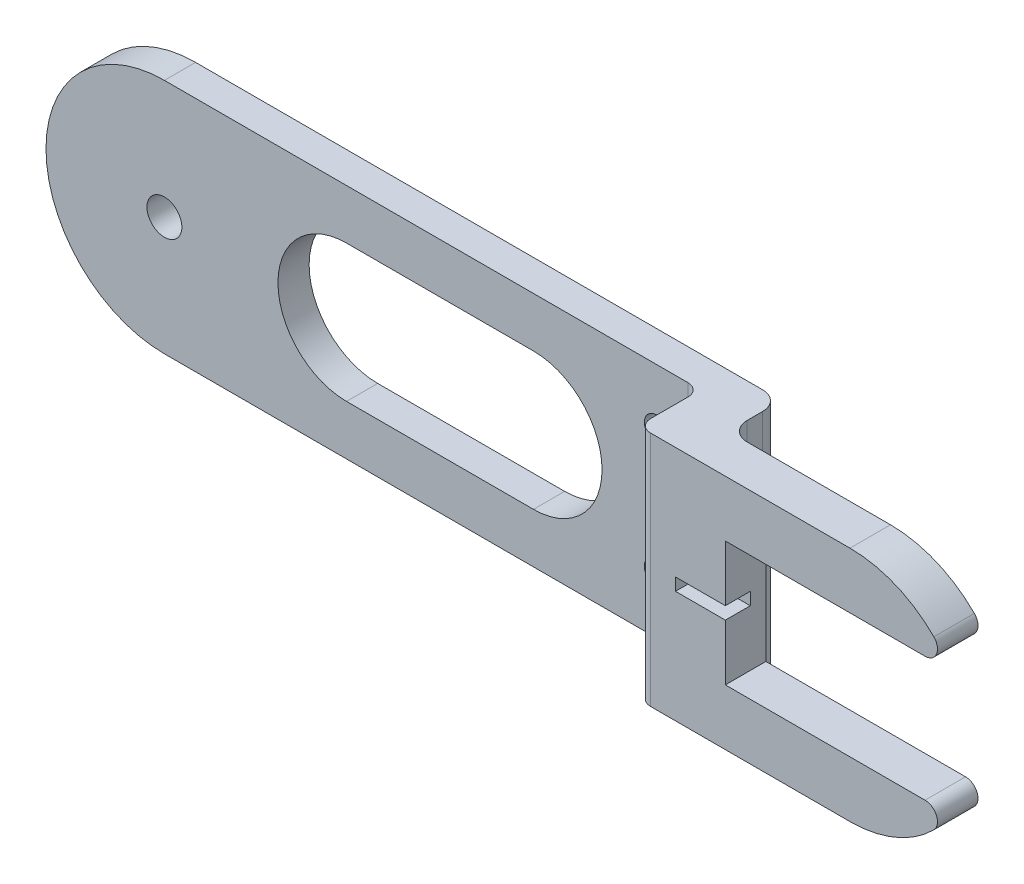
from build123d import *

# Parameters (mm, degrees)
SKETCH1_R           = 2.8
BOSS_EXTRUDE1_DEPTH = 5
FILLET1_R           = 2
BOSS_EXTRUDE2_DEPTH = 10
FILLET2_R           = 2
SKETCH3_W           = 8
SKETCH3_H           = 2
CUT_EXTRUDE1_DEPTH  = 4
SKETCH5_R           = 2
CUT_EXTRUDE2_DEPTH  = 5
SKETCH6_W           = 89.229867451
SKETCH6_H           = 38
CUT_EXTRUDE3_DEPTH  = 8.5
FILLET3_R           = 3


with BuildPart() as part:
    # Sketch1 → Boss-Extrude1 (new body)
    with BuildSketch(Plane.XY):
        with BuildLine():
            Line((0, 19), (120, 19))
            ThreePointArc((120, 19), (129.246621004, 16.598192673), (136.155494421, 10))
            Line((136.155494421, 10), (100, 10))
            Line((100, 10), (100, -10))
            Line((100, -10), (136.155494421, -10))
            ThreePointArc((136.155494421, -10), (129.246621004, -16.598192673), (120, -19))
            Line((120, -19), (0, -19))
            ThreePointArc((0, -19), (-19, 0), (0, 19))
        make_face()
        Circle(SKETCH1_R, mode=Mode.SUBTRACT)
        with BuildLine():
            Line((29.217733251, 11), (59.217733251, 11))
            ThreePointArc((59.217733251, 11), (70.217733251, 0), (59.217733251, -11))
            Line((59.217733251, -11), (29.217733251, -11))
            ThreePointArc((29.217733251, -11), (18.217733251, 0), (29.217733251, 11))
        make_face(mode=Mode.SUBTRACT)
    extrude(amount=BOSS_EXTRUDE1_DEPTH)

    # Fillet1
    fillet1_edges = [part.edges().sort_by_distance(p)[0] for p in [
        (136.155494421, 10, 2.5),
        (136.155494421, -10, 2.5),
    ]]
    fillet(fillet1_edges, radius=FILLET1_R)

    # Sketch2 → Boss-Extrude2 (add)
    with BuildSketch(Plane.XY.offset(5)):
        with BuildLine():
            Line((86, 19), (86, -19))
            Line((86, -19), (120, -19))
            ThreePointArc((120, -19), (127.286167394, -17.547414758), (133.458252765, -13.411764706))
            ThreePointArc((133.458252765, -13.411764706), (133.888690869, -11.233035011), (132.041594579, -10))
            Line((132.041594579, -10), (100, -10))
            Line((100, -10), (100, 10))
            Line((100, 10), (132.041594579, 10))
            ThreePointArc((132.041594579, 10), (133.888690869, 11.233035011), (133.458252765, 13.411764706))
            ThreePointArc((133.458252765, 13.411764706), (127.286167394, 17.547414758), (120, 19))
            Line((120, 19), (86, 19))
        make_face()
    extrude(amount=BOSS_EXTRUDE2_DEPTH)

    # Fillet2
    fillet2_edges = [part.edges().sort_by_distance(p)[0] for p in [
        (86, 0, 5),
        (86, 0, 15),
    ]]
    fillet(fillet2_edges, radius=FILLET2_R)

    # Sketch3 → Cut-Extrude1 (cut)
    with BuildSketch(Plane.XY.offset(15)):
        with Locations((96, 0)):
            Rectangle(SKETCH3_W, SKETCH3_H)
    extrude(amount=-CUT_EXTRUDE1_DEPTH, mode=Mode.SUBTRACT)

    # Sketch5 → Cut-Extrude2 (cut)
    with BuildSketch(Plane.XY.offset(5)):
        with Locations((79, 10)):
            Circle(SKETCH5_R)
        with Locations((79, -10)):
            Circle(SKETCH5_R)
    extrude(amount=-CUT_EXTRUDE2_DEPTH, mode=Mode.SUBTRACT)

    # Sketch6 → Cut-Extrude3 (cut)
    with BuildSketch(Plane(origin=(0, 0, 0), x_dir=(-1, 0, 0), z_dir=(0, 0, -1))):
        with Locations((-138.614933726, 0)):
            Rectangle(SKETCH6_W, SKETCH6_H)
    extrude(amount=-CUT_EXTRUDE3_DEPTH, mode=Mode.SUBTRACT)

    # Fillet3
    fillet3_edges = [part.edges().sort_by_distance(p)[0] for p in [
        (94, 0, 0),
        (94, 0, 8.5),
    ]]
    fillet(fillet3_edges, radius=FILLET3_R)


solid = part.part
